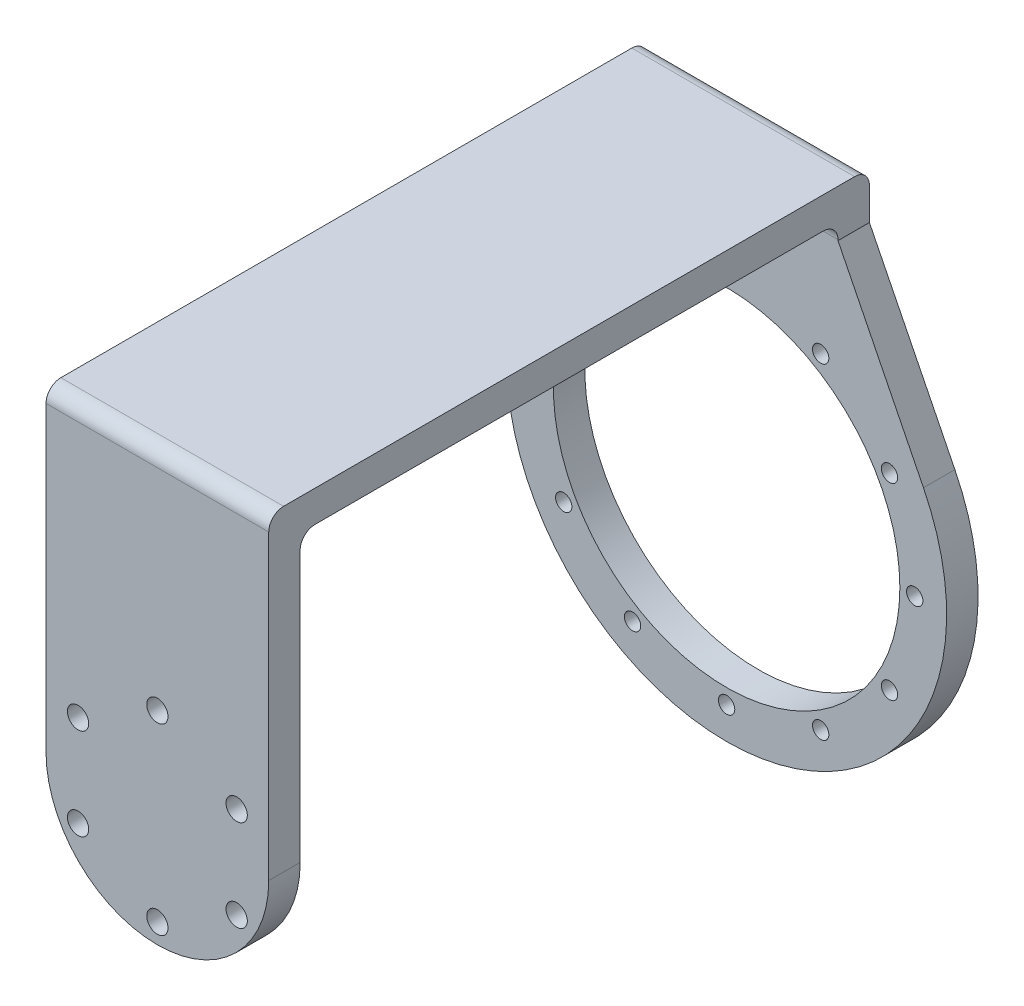
from build123d import *

# Parameters (mm, degrees)
BOSS_EXTRUDE1_START      = 115
SKETCH2_R                = 22.5
SKETCH2_R_2              = 2.15
BOSS_EXTRUDE1_DEPTH      = 6.35
SKETCH2_4_R              = 44.45
SKETCH2_4_R_2            = 35
BOSS_EXTRUDE2_DEPTH      = 6.35
SKETCH3_W                = 1.65
SKETCH3_H                = 6.35
CIRPATTERN1_COUNT        = 12
BOSS_EXTRUDE3_DEPTH      = 6.35
BOSS_EXTRUDE4_START      = 115
BOSS_EXTRUDE4_DEPTH      = 6.35
BOSS_EXTRUDE5_DEPTH      = 22.5
BOSS_EXTRUDE5_DEPTH_BACK = 22.5


with BuildPart() as part:
    # Sketch2 → Boss-Extrude1 (new body)
    with BuildSketch(Plane.XY.offset(BOSS_EXTRUDE1_START)):
        Circle(SKETCH2_R)
        with Locations((0, 18.5)):
            Circle(SKETCH2_R_2, mode=Mode.SUBTRACT)
        with Locations((16.02146997, 9.25)):
            Circle(SKETCH2_R_2, mode=Mode.SUBTRACT)
        with Locations((16.02146997, -9.25)):
            Circle(SKETCH2_R_2, mode=Mode.SUBTRACT)
        with Locations((-16.02146997, 9.25)):
            Circle(SKETCH2_R_2, mode=Mode.SUBTRACT)
        with Locations((-16.02146997, -9.25)):
            Circle(SKETCH2_R_2, mode=Mode.SUBTRACT)
        with Locations((0, -18.5)):
            Circle(SKETCH2_R_2, mode=Mode.SUBTRACT)
    extrude(amount=BOSS_EXTRUDE1_DEPTH)

    # Sketch4<4> → Boss-Extrude4 (add)
    with BuildSketch(Plane.XY.offset(BOSS_EXTRUDE4_START)):
        with BuildLine():
            Line((-22.5, 54.45), (-22.5, 38.334742728))
            ThreePointArc((-22.5, 38.334742728), (0, 44.45), (22.5, 38.334742728))
            Line((22.5, 38.334742728), (22.5, 54.45))
            Line((22.5, 54.45), (-22.5, 54.45))
        make_face()
        with BuildLine():
            Line((-22.5, 38.334742728), (-22.5, 0))
            ThreePointArc((-22.5, 0), (0, 22.5), (22.5, 0))
            Line((22.5, 0), (22.5, 38.334742728))
            ThreePointArc((22.5, 38.334742728), (0, 44.45), (-22.5, 38.334742728))
        make_face()
    extrude(amount=BOSS_EXTRUDE4_DEPTH)



with BuildPart() as body_2:
    # Sketch2<4> → Boss-Extrude2 (new body)
    with BuildSketch(Plane.XY):
        Circle(SKETCH2_4_R)
        Circle(SKETCH2_4_R_2, mode=Mode.SUBTRACT)
    extrude(amount=BOSS_EXTRUDE2_DEPTH)

    # Sketch3 → M4x0.7 Tapped Hole1 (revolve, cut)
    with BuildSketch(Plane(origin=(0, 38, 6.35), x_dir=(0, -1, 0), z_dir=(1, 0, 0))):
        with Locations((0.825, 3.175)):
            Rectangle(SKETCH3_W, SKETCH3_H)
    m4x0_7_tapped_hole1 = revolve(axis=Axis((0, 38, 12.7), (0, 0, -1)), mode=Mode.SUBTRACT)

    # CirPattern1: M4x0.7 Tapped Hole1 ×12 about axis
    cirpattern1_axis = Axis((0, 0, 0), (0, 0, 1))
    for i in range(1, CIRPATTERN1_COUNT):
        add(m4x0_7_tapped_hole1.rotate(cirpattern1_axis, i * 360 / CIRPATTERN1_COUNT), mode=Mode.SUBTRACT)

    # Sketch4 → Boss-Extrude3 (add)
    with BuildSketch(Plane.XY):
        with BuildLine():
            Line((-39.770338523, 19.852523108), (-22.5, 54.45))
            Line((-22.5, 54.45), (22.5, 54.45))
            Line((22.5, 54.45), (39.770338523, 19.852523108))
            ThreePointArc((39.770338523, 19.852523108), (0, 44.45), (-39.770338523, 19.852523108))
        make_face()
    extrude(amount=BOSS_EXTRUDE3_DEPTH)


with BuildPart() as part_1:
    add(part.part)

    add(body_2.part)  # Boss-Extrude5 merges body 2
    # Sketch5 → Boss-Extrude5 (add, two sides: drawn at the far end of the back side and taken through both)
    with BuildSketch(Plane(origin=(0, 0, 0), x_dir=(0, 0, -1), z_dir=(1, 0, 0)).offset(-BOSS_EXTRUDE5_DEPTH_BACK)):
        with BuildLine():
            Line((0, 54.45), (0, 60.975))
            ThreePointArc((0, 60.975), (-0.878679656, 63.096320344), (-3, 63.975))
            Line((-3, 63.975), (-118.35, 63.975))
            ThreePointArc((-118.35, 63.975), (-120.471320344, 63.096320344), (-121.35, 60.975))
            Line((-121.35, 60.975), (-121.35, 54.45))
            Line((-121.35, 54.45), (-115, 54.45))
            Line((-115, 54.45), (-115, 54.625))
            ThreePointArc((-115, 54.625), (-114.121320344, 56.746320344), (-112, 57.625))
            Line((-112, 57.625), (-9.35, 57.625))
            ThreePointArc((-9.35, 57.625), (-7.228679656, 56.746320344), (-6.35, 54.625))
            Line((-6.35, 54.625), (-6.35, 54.45))
            Line((-6.35, 54.45), (0, 54.45))
        make_face()
    extrude(amount=BOSS_EXTRUDE5_DEPTH + BOSS_EXTRUDE5_DEPTH_BACK)


solid = part_1.part
